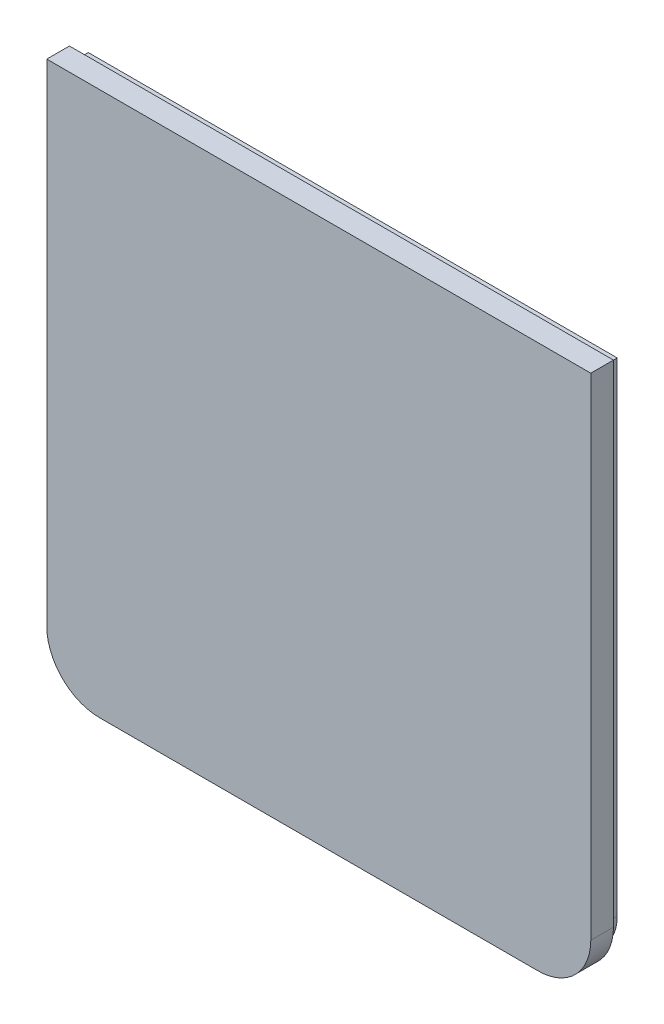
from build123d import *

# Parameters (mm, degrees)
BOSS_EXTRUDE1_DEPTH = 6
BOSS_EXTRUDE2_DEPTH = 3


with BuildPart() as part:
    # Sketch1 → Boss-Extrude1 (new body)
    with BuildSketch(Plane.XY):
        with BuildLine():
            Line((-58, -72), (58, -72))
            ThreePointArc((58, -72), (67.899494937, -67.899494937), (72, -58))
            Line((72, -58), (72, 72))
            Line((72, 72), (-72, 72))
            Line((-72, 72), (-72, -58))
            ThreePointArc((-72, -58), (-67.899494937, -67.899494937), (-58, -72))
        make_face()
    extrude(amount=BOSS_EXTRUDE1_DEPTH)

    # Sketch2 → Boss-Extrude2 (add)
    with BuildSketch(Plane(origin=(0, 0, 0), x_dir=(-1, 0, 0), z_dir=(0, 0, -1))):
        with BuildLine():
            Line((-70, 70), (-70, -58))
            ThreePointArc((-70, -58), (-66.485281374, -66.485281374), (-58, -70))
            Line((-58, -70), (58, -70))
            ThreePointArc((58, -70), (66.485281374, -66.485281374), (70, -58))
            Line((70, -58), (70, 70))
            Line((70, 70), (-70, 70))
        make_face()
        with BuildLine():
            Line((-67, 67), (-67, -58))
            ThreePointArc((-67, -58), (-64.363961031, -64.363961031), (-58, -67))
            Line((-58, -67), (58, -67))
            ThreePointArc((58, -67), (64.363961031, -64.363961031), (67, -58))
            Line((67, -58), (67, 67))
            Line((67, 67), (-67, 67))
        make_face(mode=Mode.SUBTRACT)
    extrude(amount=BOSS_EXTRUDE2_DEPTH)


solid = part.part
